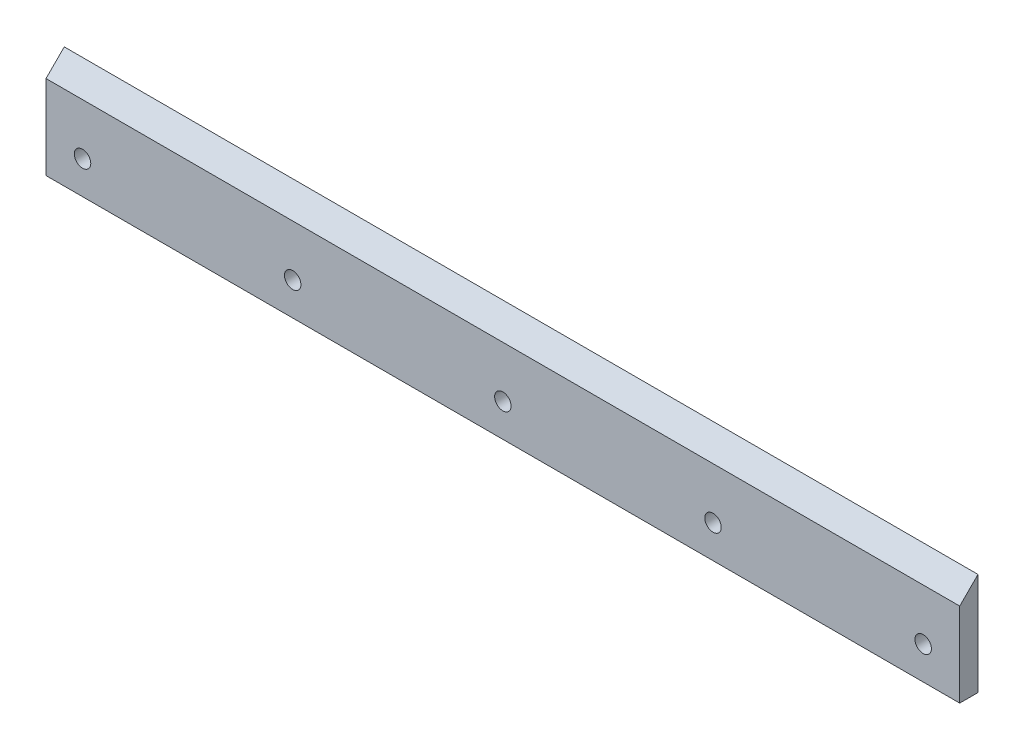
from build123d import *

# Parameters (mm, degrees)
BOSS_EXTRUDE1_DEPTH  = 250
M4_CLEARANCE_HOLE1_D = 4.5
LPATTERN1_COUNT      = 5
LPATTERN1_PITCH      = 57.5


with BuildPart() as part:
    # Sketch1 → Boss-Extrude1 (new body)
    with BuildSketch(Plane(origin=(0, 0, 0), x_dir=(0, 0, -1), z_dir=(1, 0, 0))):
        Polygon((-5, 23), (0, 28), (0, 0), (-5, 0), align=None)
    extrude(amount=BOSS_EXTRUDE1_DEPTH)

    # M4 Clearance Hole1 (through all)
    with Locations(Plane.XY.offset(5)):
        with Locations((10, 9)):
            m4_clearance_hole1 = Hole(M4_CLEARANCE_HOLE1_D / 2)

    # LPattern1: M4 Clearance Hole1 ×5
    with Locations(*[(i * LPATTERN1_PITCH, 0, 0) for i in range(1, LPATTERN1_COUNT)]):
        add(m4_clearance_hole1, mode=Mode.SUBTRACT)


solid = part.part
